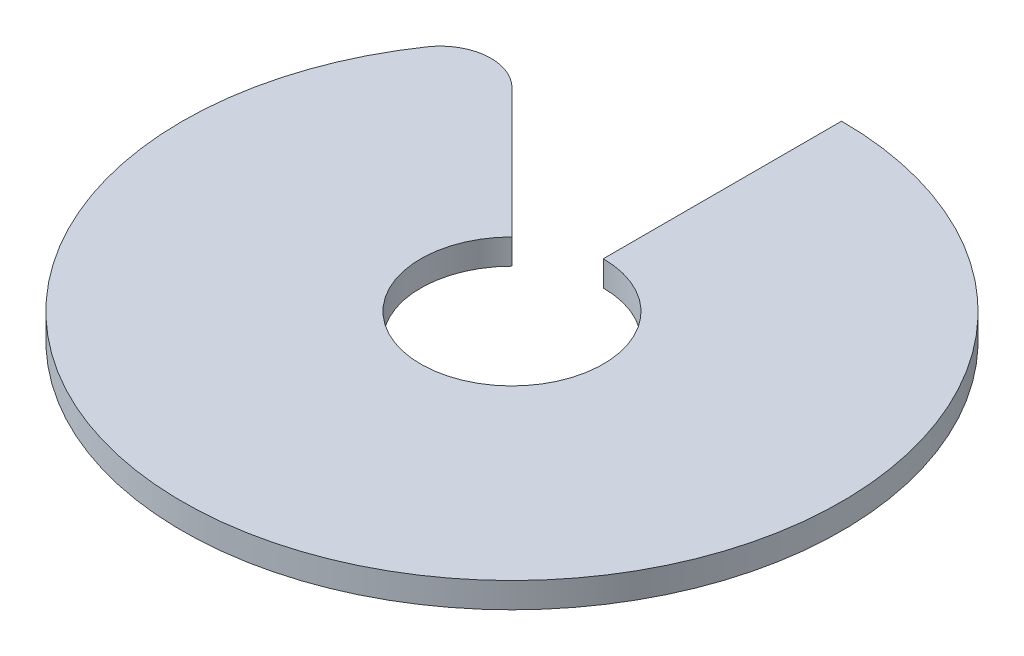
from build123d import *

# Parameters (mm, degrees)
EXTRUDE_1_DEPTH = 5
FILLET_1_R      = 10


with BuildPart() as part:
    # Эскиз1 → Бобышка-Вытянуть1 (new body)
    with BuildSketch(Plane(origin=(0, 0, 0), x_dir=(1, 0, 0), z_dir=(0, 1, 0))):
        with BuildLine():
            Line((-12.727922061, 12.727922061), (-45.961940777, 45.961940777))
            ThreePointArc((-45.961940777, 45.961940777), (24.874423104, -60.052169613), (0, 65))
            Line((0, 65), (0, 18))
            ThreePointArc((0, 18), (6.888301783, -16.629831585), (-12.727922061, 12.727922061))
        make_face()
    extrude(amount=EXTRUDE_1_DEPTH)

    # Скругление1
    fillet_1_edges = [part.edges().sort_by_distance(p)[0] for p in [
        (-45.961940777, 2.5, -45.961940777),
    ]]
    fillet(fillet_1_edges, radius=FILLET_1_R)


solid = part.part
